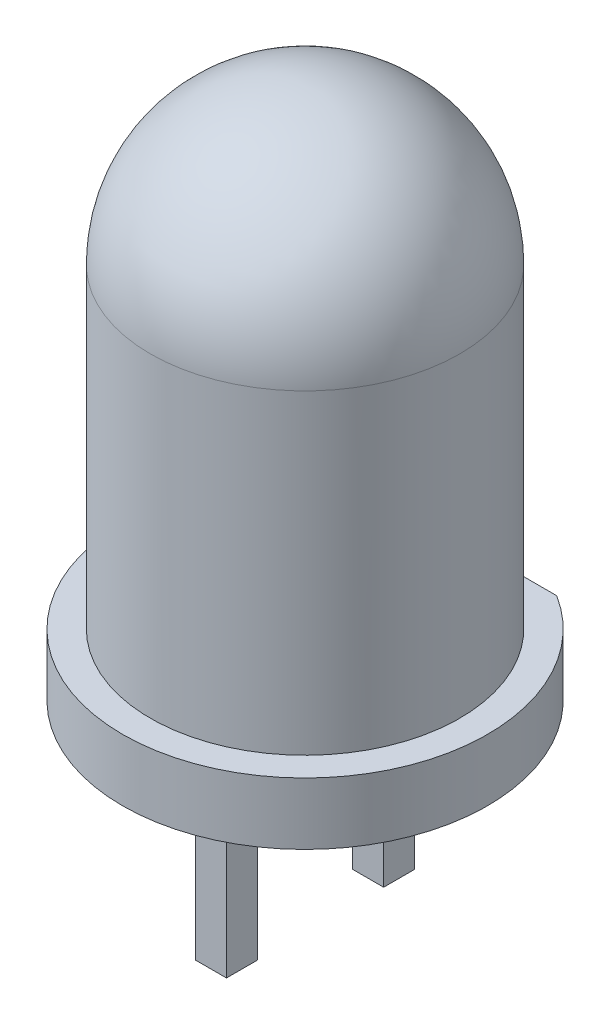
from build123d import *

# Parameters (mm, degrees)
SKETCH1_R           = 2.95
BOSS_EXTRUDE1_DEPTH = 1
SKETCH2_R           = 2.5
BOSS_EXTRUDE2_DEPTH = 7.6
CUT_EXTRUDE1_START  = -7.6
CUT_EXTRUDE1_DEPTH  = 7.6
FILLET1_R           = 2.5
SKETCH4_W           = 0.5
SKETCH4_H           = 0.5
BOSS_EXTRUDE3_DEPTH = 3


with BuildPart() as part:
    # Sketch1 → Boss-Extrude1 (new body)
    with BuildSketch(Plane(origin=(0, 0, 0), x_dir=(1, 0, 0), z_dir=(0, 1, 0))):
        with Locations(Location((0, 0, 0), (0, 0, 270))):
            Circle(SKETCH1_R)
    extrude(amount=BOSS_EXTRUDE1_DEPTH)

    # Sketch2 → Boss-Extrude2 (add)
    with BuildSketch(Plane(origin=(0, 1, 0), x_dir=(1, 0, 0), z_dir=(0, 1, 0))):
        with Locations(Location((0, 0, 0), (0, 0, 90))):
            Circle(SKETCH2_R)
    extrude(amount=BOSS_EXTRUDE2_DEPTH)

    # Sketch3 → Cut-Extrude1 (cut)
    with BuildSketch(Plane(origin=(0, 1, 0), x_dir=(1, 0, 0), z_dir=(0, 1, 0)).offset(CUT_EXTRUDE1_START)):
        with BuildLine():
            Line((-1.566045976, 2.5), (1.566045976, 2.5))
            ThreePointArc((1.566045976, 2.5), (0, 2.95), (-1.566045976, 2.5))
        make_face()
    extrude(amount=CUT_EXTRUDE1_DEPTH, mode=Mode.SUBTRACT)

    # Fillet1
    fillet1_edges = [part.edges().sort_by_distance(p)[0] for p in [
        (0, 8.6, 2.5),
    ]]
    fillet(fillet1_edges, radius=FILLET1_R)

    # Sketch4 → Boss-Extrude3 (add)
    with BuildSketch(Plane.XZ):
        with Locations((0, 1.27)):
            Rectangle(SKETCH4_W, SKETCH4_H)
        with Locations((0, -1.27)):
            Rectangle(SKETCH4_W, SKETCH4_H)
    extrude(amount=BOSS_EXTRUDE3_DEPTH)


solid = part.part
